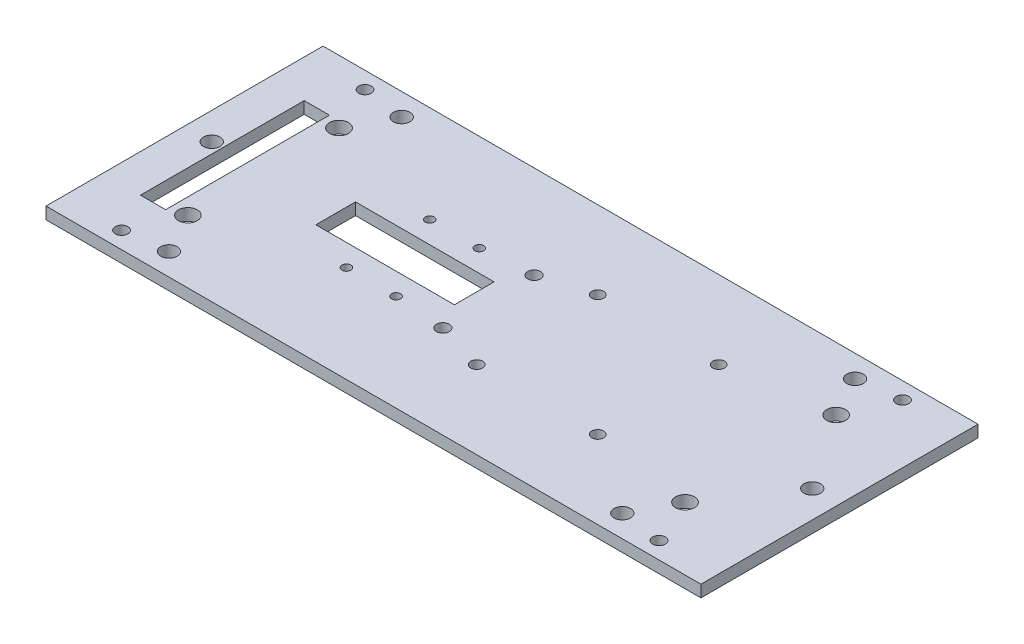
from build123d import *

# Parameters (mm, degrees)
SKETCH1_W           = 165.1
SKETCH1_H           = 69.85
BOSS_EXTRUDE1_DEPTH = 3
CUT_EXTRUDE1_REACH  = 91.684
SKETCH6_W           = 34.925
SKETCH6_H           = 10
SKETCH6_R           = 1.5
SKETCH6_R_2         = 1.625
CUT_EXTRUDE3_REACH  = 91.684
SKETCH8_R           = 2.38125
SKETCH9_R           = 2.0828
CUT_EXTRUDE5_DEPTH  = 5.08
SKETCH10_R          = 2.0828
CUT_EXTRUDE6_DEPTH  = 5.08
SKETCH11_R          = 1.125
SKETCH11_R_2        = 1.125000036
CUT_EXTRUDE7_DEPTH  = 41.91
SKETCH13_R          = 1.5875
CUT_EXTRUDE9_DEPTH  = 5
SKETCH15_W          = 6.35
SKETCH15_H          = 41.275
CUT_EXTRUDE10_DEPTH = 7.62


with BuildPart() as part:
    # Sketch1 → Boss-Extrude1 (new body)
    with BuildSketch(Plane(origin=(0, 0, 0), x_dir=(1, 0, 0), z_dir=(0, 1, 0))):
        Rectangle(SKETCH1_W, SKETCH1_H)
    extrude(amount=BOSS_EXTRUDE1_DEPTH)

    # Sketch6 → Cut-Extrude1 (cut, up to next)
    with BuildSketch(Plane.XZ, mode=Mode.PRIVATE) as cut_extrude1_sk1:
        with Locations((-26.9875, 0)):
            Rectangle(SKETCH6_W, SKETCH6_H)
    cut_extrude1_tool1 = extrude(cut_extrude1_sk1.sketch, amount=-CUT_EXTRUDE1_REACH, mode=Mode.PRIVATE) & part.part
    # Sketch6 → Cut-Extrude1 (cut, up to next)
    with BuildSketch(Plane.XZ, mode=Mode.PRIVATE) as cut_extrude1_sk2:
        with Locations((6.35, 15.25)):
            Circle(SKETCH6_R)
    cut_extrude1_tool2 = extrude(cut_extrude1_sk2.sketch, amount=-CUT_EXTRUDE1_REACH, mode=Mode.PRIVATE) & part.part
    # Sketch6 → Cut-Extrude1 (cut, up to next)
    with BuildSketch(Plane.XZ, mode=Mode.PRIVATE) as cut_extrude1_sk3:
        with Locations((36.85, 15.25)):
            Circle(SKETCH6_R)
    cut_extrude1_tool3 = extrude(cut_extrude1_sk3.sketch, amount=-CUT_EXTRUDE1_REACH, mode=Mode.PRIVATE) & part.part
    # Sketch6 → Cut-Extrude1 (cut, up to next)
    with BuildSketch(Plane.XZ, mode=Mode.PRIVATE) as cut_extrude1_sk4:
        with Locations((6.35, -15.25)):
            Circle(SKETCH6_R)
    cut_extrude1_tool4 = extrude(cut_extrude1_sk4.sketch, amount=-CUT_EXTRUDE1_REACH, mode=Mode.PRIVATE) & part.part
    # Sketch6 → Cut-Extrude1 (cut, up to next)
    with BuildSketch(Plane.XZ, mode=Mode.PRIVATE) as cut_extrude1_sk5:
        with Locations((36.85, -15.25)):
            Circle(SKETCH6_R)
    cut_extrude1_tool5 = extrude(cut_extrude1_sk5.sketch, amount=-CUT_EXTRUDE1_REACH, mode=Mode.PRIVATE) & part.part
    # Sketch6 → Cut-Extrude1 (cut, up to next)
    with BuildSketch(Plane.XZ, mode=Mode.PRIVATE) as cut_extrude1_sk6:
        with Locations((-5.924999961, 11.500993)):
            Circle(SKETCH6_R_2)
    cut_extrude1_tool6 = extrude(cut_extrude1_sk6.sketch, amount=-CUT_EXTRUDE1_REACH, mode=Mode.PRIVATE) & part.part
    # Sketch6 → Cut-Extrude1 (cut, up to next)
    with BuildSketch(Plane.XZ, mode=Mode.PRIVATE) as cut_extrude1_sk7:
        with Locations((-5.924999961, -11.500993)):
            Circle(SKETCH6_R_2)
    cut_extrude1_tool7 = extrude(cut_extrude1_sk7.sketch, amount=-CUT_EXTRUDE1_REACH, mode=Mode.PRIVATE) & part.part
    add(cut_extrude1_tool1.solids().sort_by_distance((-26.9875, 0, 0))[0], mode=Mode.SUBTRACT)
    add(cut_extrude1_tool2.solids().sort_by_distance((6.35, 0, 15.25))[0], mode=Mode.SUBTRACT)
    add(cut_extrude1_tool3.solids().sort_by_distance((36.85, 0, 15.25))[0], mode=Mode.SUBTRACT)
    add(cut_extrude1_tool4.solids().sort_by_distance((6.35, 0, -15.25))[0], mode=Mode.SUBTRACT)
    add(cut_extrude1_tool5.solids().sort_by_distance((36.85, 0, -15.25))[0], mode=Mode.SUBTRACT)
    add(cut_extrude1_tool6.solids().sort_by_distance((-5.925, 0, 11.500993))[0], mode=Mode.SUBTRACT)
    add(cut_extrude1_tool7.solids().sort_by_distance((-5.925, 0, -11.500993))[0], mode=Mode.SUBTRACT)

    # Sketch8 → Cut-Extrude3 (cut, up to next)
    with BuildSketch(Plane(origin=(0, 3, 0), x_dir=(1, 0, 0), z_dir=(0, 1, 0)), mode=Mode.PRIVATE) as cut_extrude3_sk1:
        with Locations((-62.6618, -19.05)):
            Circle(SKETCH8_R)
    cut_extrude3_tool1 = extrude(cut_extrude3_sk1.sketch, amount=-CUT_EXTRUDE3_REACH, mode=Mode.PRIVATE) & part.part
    # Sketch8 → Cut-Extrude3 (cut, up to next)
    with BuildSketch(Plane(origin=(0, 3, 0), x_dir=(1, 0, 0), z_dir=(0, 1, 0)), mode=Mode.PRIVATE) as cut_extrude3_sk2:
        with Locations((-62.6618, 19.05)):
            Circle(SKETCH8_R)
    cut_extrude3_tool2 = extrude(cut_extrude3_sk2.sketch, amount=-CUT_EXTRUDE3_REACH, mode=Mode.PRIVATE) & part.part
    # Sketch8 → Cut-Extrude3 (cut, up to next)
    with BuildSketch(Plane(origin=(0, 3, 0), x_dir=(1, 0, 0), z_dir=(0, 1, 0)), mode=Mode.PRIVATE) as cut_extrude3_sk3:
        with Locations((62.6618, 19.05)):
            Circle(SKETCH8_R)
    cut_extrude3_tool3 = extrude(cut_extrude3_sk3.sketch, amount=-CUT_EXTRUDE3_REACH, mode=Mode.PRIVATE) & part.part
    # Sketch8 → Cut-Extrude3 (cut, up to next)
    with BuildSketch(Plane(origin=(0, 3, 0), x_dir=(1, 0, 0), z_dir=(0, 1, 0)), mode=Mode.PRIVATE) as cut_extrude3_sk4:
        with Locations((62.6618, -19.05)):
            Circle(SKETCH8_R)
    cut_extrude3_tool4 = extrude(cut_extrude3_sk4.sketch, amount=-CUT_EXTRUDE3_REACH, mode=Mode.PRIVATE) & part.part
    add(cut_extrude3_tool1.solids().sort_by_distance((-62.6618, 3, 19.05))[0], mode=Mode.SUBTRACT)
    add(cut_extrude3_tool2.solids().sort_by_distance((-62.6618, 3, -19.05))[0], mode=Mode.SUBTRACT)
    add(cut_extrude3_tool3.solids().sort_by_distance((62.6618, 3, -19.05))[0], mode=Mode.SUBTRACT)
    add(cut_extrude3_tool4.solids().sort_by_distance((62.6618, 3, 19.05))[0], mode=Mode.SUBTRACT)

    # Sketch9 → Cut-Extrude5 (cut)
    with BuildSketch(Plane(origin=(0, 3, 0), x_dir=(1, 0, 0), z_dir=(0, 1, 0))):
        with Locations((-75.692, 0)):
            Circle(SKETCH9_R)
        with Locations((75.692, 0)):
            Circle(SKETCH9_R)
    extrude(amount=-CUT_EXTRUDE5_DEPTH, mode=Mode.SUBTRACT)

    # Sketch10 → Cut-Extrude6 (cut)
    with BuildSketch(Plane(origin=(0, 3, 0), x_dir=(1, 0, 0), z_dir=(0, 1, 0))):
        with Locations((57.15, -29.337)):
            Circle(SKETCH10_R)
        with Locations((57.15, 29.337)):
            Circle(SKETCH10_R)
        with Locations((-57.15, -29.337)):
            Circle(SKETCH10_R)
        with Locations((-57.15, 29.337)):
            Circle(SKETCH10_R)
    extrude(amount=-CUT_EXTRUDE6_DEPTH, mode=Mode.SUBTRACT)

    # Sketch11 → Cut-Extrude7 (cut)
    with BuildSketch(Plane(origin=(0, 3, 0), x_dir=(1, 0, 0), z_dir=(0, 1, 0))):
        with Locations((-31.2375, 10.5)):
            Circle(SKETCH11_R)
        with Locations((-18.7375, 10.5)):
            Circle(SKETCH11_R_2)
        with Locations((-18.7375, -10.5)):
            Circle(SKETCH11_R_2)
        with Locations((-31.2375, -10.5)):
            Circle(SKETCH11_R_2)
    extrude(amount=-CUT_EXTRUDE7_DEPTH, mode=Mode.SUBTRACT)

    # Sketch13 → Cut-Extrude9 (cut)
    with BuildSketch(Plane.XZ):
        with Locations((-67.742170098, 30.689580734)):
            Circle(SKETCH13_R)
        with Locations((67.742170098, 30.689580734)):
            Circle(SKETCH13_R)
        with Locations((67.742170098, -30.689580734)):
            Circle(SKETCH13_R)
        with Locations((-67.742170098, -30.689580734)):
            Circle(SKETCH13_R)
    extrude(amount=-CUT_EXTRUDE9_DEPTH, mode=Mode.SUBTRACT)

    # Sketch15 → Cut-Extrude10 (cut)
    with BuildSketch(Plane.XZ):
        with Locations((-69.85, 0)):
            Rectangle(SKETCH15_W, SKETCH15_H)
    extrude(amount=-CUT_EXTRUDE10_DEPTH, mode=Mode.SUBTRACT)


solid = part.part
